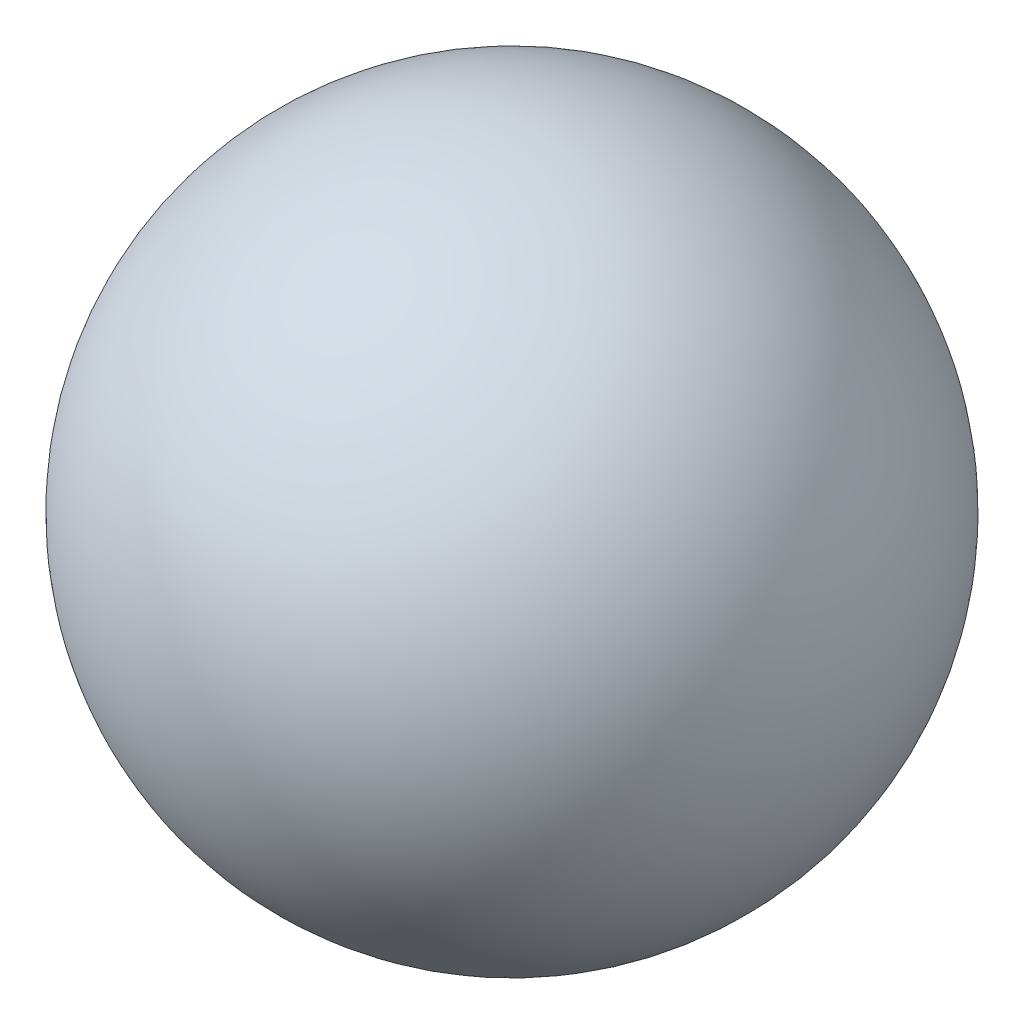
from build123d import *


with BuildPart() as part:
    # Sketch1 → Revolve1 (revolve)
    with BuildSketch(Plane(origin=(0, 0, 0), x_dir=(1, 0, 0), z_dir=(0, 1, 0))):
        with BuildLine():
            Line((0, 36.83), (0, -36.83))
            ThreePointArc((0, -36.83), (36.83, 0), (0, 36.83))
        make_face()
    revolve(axis=Axis((0, 0, -36.83), (0, 0, 1)))


solid = part.part
